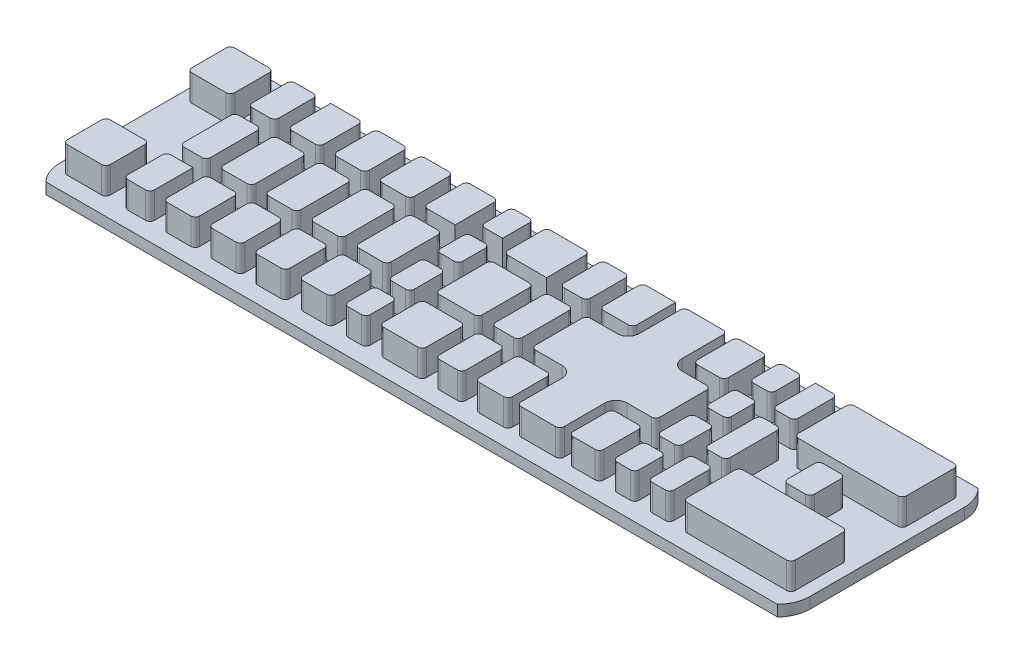
from build123d import *

# Parameters (mm, degrees)
SKETCH1_W                = 218.44
SKETCH1_H                = 50.8
BOSS_EXTRUDE1_DEPTH      = 2.54
SKETCH5_W                = 9.906
SKETCH5_H                = 9.906
SKETCH5_W_2              = 6.096
SKETCH5_H_2              = 12.7
SKETCH5_W_3              = 7.366
SKETCH5_W_4              = 5.08
SKETCH5_H_3              = 7.112
SKETCH5_H_4              = 8.128
SKETCH5_W_5              = 7.62
SKETCH5_W_6              = 7.112
SKETCH5_W_7              = 5.0038
SKETCH5_H_5              = 6.828713061
SKETCH5_H_6              = 8.141940284
SKETCH5_W_8              = 24.9174
SKETCH5_H_7              = 12.954
BOSS_EXTRUDE4_DEPTH      = 6.096
FILLET8_R                = 2.54
FILLET9_R                = 7.62
FILLET10_R               = 1.016
FILLET11_R               = 1.016
SKETCH10_W               = 7.932558553
SKETCH10_H               = 50.796984233
CUT_EXTRUDE4_DEPTH       = 113.466656819
SKETCH11_W               = 11.285421997
SKETCH11_H               = 50.860782752
CUT_EXTRUDE5_DEPTH       = 10.16
SKETCH12_R               = 2.54
CUT_EXTRUDE6_DEPTH       = 1.27
SKETCH15_W               = 30.193219406
SKETCH15_H               = 50.796984233
CUT_EXTRUDE9_DEPTH       = 106.289623737
SKETCH17_W               = 30.370824295
SKETCH17_H               = 2.54
CUT_EXTRUDE11_DEPTH      = 115.111282819
CUT_EXTRUDE12_DEPTH      = 114.918717089
CUT_EXTRUDE12_DEPTH_BACK = 114.918717089
SKETCH18_W               = 0.041845094
SKETCH18_H               = 2.54
FILLET12_R               = 7.62
CUT_EXTRUDE14_DEPTH      = 106.082351021
CUT_EXTRUDE14_DEPTH_BACK = 3.81
SKETCH19_W               = 173.006780594
SKETCH19_H               = 2.286
CUT_EXTRUDE15_DEPTH      = 106.082351021
CUT_EXTRUDE15_DEPTH_BACK = 106.082351021
SKETCH20_W               = 173.059844392
SKETCH20_H               = 2.286
SKETCH21_R               = 0.381
CUT_EXTRUDE16_DEPTH      = 1.27


with BuildPart() as part:
    # Sketch1 → Boss-Extrude1 (new body)
    with BuildSketch(Plane(origin=(0, 0, 0), x_dir=(1, 0, 0), z_dir=(0, 1, 0))):
        Rectangle(SKETCH1_W, SKETCH1_H)
    extrude(amount=BOSS_EXTRUDE1_DEPTH)

    # Sketch5 → Boss-Extrude4 (add)
    with BuildSketch(Plane(origin=(0, 2.54, 0), x_dir=(1, 0, 0), z_dir=(0, 1, 0))):
        with BuildLine():
            Line((5.334, 19.304), (5.334, 6.35))
            Line((5.334, 6.35), (-4.318, 6.35))
            Line((-4.318, 6.35), (-4.318, -6.35))
            Line((-4.318, -6.35), (5.334, -6.35))
            Line((5.334, -6.35), (5.334, -19.304))
            Line((5.334, -19.304), (15.24, -19.304))
            Line((15.24, -19.304), (15.24, -8.89))
            ThreePointArc((15.24, -8.89), (15.983948776, -7.093948776), (17.78, -6.35))
            Line((17.78, -6.35), (24.384, -6.35))
            Line((24.384, -6.35), (24.384, 6.35))
            Line((24.384, 6.35), (17.78, 6.35))
            ThreePointArc((17.78, 6.35), (15.983948776, 7.093948776), (15.24, 8.89))
            Line((15.24, 8.89), (15.24, 19.304))
            Line((15.24, 19.304), (5.334, 19.304))
        make_face()
        with Locations((-94.361, 14.351)):
            Rectangle(SKETCH5_W, SKETCH5_H)
        with Locations((-94.361, -14.351)):
            Rectangle(SKETCH5_W, SKETCH5_H)
        with Locations((-82.296, -14.351)):
            Rectangle(SKETCH5_W_2, SKETCH5_H)
        with Locations((-82.296, 0)):
            Rectangle(SKETCH5_W_2, SKETCH5_H_2)
        with Locations((-82.296, 14.351)):
            Rectangle(SKETCH5_W_2, SKETCH5_H)
        with Locations((-72.517, 14.351)):
            Rectangle(SKETCH5_W_3, SKETCH5_H)
        with Locations((-72.517, 0)):
            Rectangle(SKETCH5_W_3, SKETCH5_H_2)
        with Locations((-72.517, -14.351)):
            Rectangle(SKETCH5_W_3, SKETCH5_H)
        with Locations((-62.103, -14.351)):
            Rectangle(SKETCH5_W_3, SKETCH5_H)
        with Locations((-62.103, 0)):
            Rectangle(SKETCH5_W_3, SKETCH5_H_2)
        with Locations((-62.103, 14.351)):
            Rectangle(SKETCH5_W_3, SKETCH5_H)
        with Locations((-51.689, 14.351)):
            Rectangle(SKETCH5_W_3, SKETCH5_H)
        with Locations((-51.689, 0)):
            Rectangle(SKETCH5_W_3, SKETCH5_H_2)
        with Locations((-51.689, -14.351)):
            Rectangle(SKETCH5_W_3, SKETCH5_H)
        with Locations((-41.275, -14.351)):
            Rectangle(SKETCH5_W_3, SKETCH5_H)
        with Locations((-41.275, 0)):
            Rectangle(SKETCH5_W_3, SKETCH5_H_2)
        with Locations((-41.275, 14.351)):
            Rectangle(SKETCH5_W_3, SKETCH5_H)
        with Locations((-32.004, 15.748)):
            Rectangle(SKETCH5_W_4, SKETCH5_H_3)
        with Locations((-32.004, 5.588)):
            Rectangle(SKETCH5_W_4, SKETCH5_H_3)
        with Locations((-32.004, -5.08)):
            Rectangle(SKETCH5_W_4, SKETCH5_H_4)
        with Locations((-21.463, 0)):
            Rectangle(SKETCH5_W, SKETCH5_H_2)
        with Locations((-21.463, 14.351)):
            Rectangle(SKETCH5_W, SKETCH5_H)
        with Locations((-10.414, 14.351)):
            Rectangle(SKETCH5_W_2, SKETCH5_H)
        with Locations((-0.508, 14.351)):
            Rectangle(SKETCH5_W_5, SKETCH5_H)
        with Locations((-10.414, 0)):
            Rectangle(SKETCH5_W_2, SKETCH5_H_2)
        with Locations((-32.004, -15.748)):
            Rectangle(SKETCH5_W_4, SKETCH5_H_3)
        with Locations((-21.463, -14.351)):
            Rectangle(SKETCH5_W, SKETCH5_H)
        with Locations((-10.414, -14.351)):
            Rectangle(SKETCH5_W_2, SKETCH5_H)
        with Locations((-0.508, -14.351)):
            Rectangle(SKETCH5_W_5, SKETCH5_H)
        with Locations((20.828, -14.351)):
            Rectangle(SKETCH5_W_6, SKETCH5_H)
        with Locations((29.972, -15.748)):
            Rectangle(SKETCH5_W_4, SKETCH5_H_3)
        with Locations((38.0619, -14.351)):
            Rectangle(SKETCH5_W_7, SKETCH5_H)
        with Locations((29.972, -5.08)):
            Rectangle(SKETCH5_W_4, SKETCH5_H_4)
        with Locations((29.972, 5.446356531)):
            Rectangle(SKETCH5_W_4, SKETCH5_H_5)
        with Locations((29.972, 15.748)):
            Rectangle(SKETCH5_W_4, SKETCH5_H_3)
        with Locations((20.828, 14.351)):
            Rectangle(SKETCH5_W_6, SKETCH5_H)
        with Locations((38.0619, 14.351)):
            Rectangle(SKETCH5_W_7, SKETCH5_H)
        with Locations((38.0619, 0)):
            Rectangle(SKETCH5_W_7, SKETCH5_H_2)
        with Locations((54.5338, 0.08685337)):
            Rectangle(SKETCH5_W_2, SKETCH5_H_6)
        with Locations((56.0705, -12.827)):
            Rectangle(SKETCH5_W_8, SKETCH5_H_7)
        with Locations((56.0705, 12.827)):
            Rectangle(SKETCH5_W_8, SKETCH5_H_7)
    extrude(amount=BOSS_EXTRUDE4_DEPTH)

    # Fillet8
    fillet8_edges = [part.edges().sort_by_distance(p)[0] for p in [
        (5.334, 5.588, -6.35),
        (5.334, 5.588, 6.35),
    ]]
    fillet(fillet8_edges, radius=FILLET8_R)

    # Fillet9
    fillet9_edges = [part.edges().sort_by_distance(p)[0] for p in [
        (-109.22, 1.27, -25.4),
        (-109.22, 1.27, 25.4),
        (109.22, 1.27, 25.4),
        (109.22, 1.27, -25.4),
    ]]
    fillet(fillet9_edges, radius=FILLET9_R)

    # Fillet10
    fillet10_edges = [part.edges().sort_by_distance(p)[0] for p in [
        (40.5638, 5.588, -6.35),
        (32.512, 5.588, -8.860713061),
        (32.512, 5.588, -19.304),
        (40.5638, 5.588, -19.304),
        (17.272, 5.588, -19.304),
        (24.384, 5.588, -19.304),
        (27.432, 5.588, -19.304),
        (27.432, 5.588, -8.860713061),
        (27.432, 5.588, 1.016),
        (27.432, 5.588, 12.192),
        (24.384, 5.588, 9.398),
        (32.512, 5.588, -12.192),
        (32.512, 5.588, -2.032),
        (32.512, 5.588, 1.016),
        (32.512, 5.588, 12.192),
        (32.512, 5.588, 9.144),
        (24.384, 5.588, 19.304),
        (17.272, 5.588, 19.304),
        (17.272, 5.588, 9.398),
        (17.272, 5.588, -9.398),
        (24.384, 5.588, -9.398),
        (27.432, 5.588, -12.192),
        (27.432, 5.588, -2.032),
        (27.432, 5.588, 9.144),
        (27.432, 5.588, 19.304),
        (32.512, 5.588, 19.304),
        (35.56, 5.588, -6.35),
        (40.5638, 5.588, -9.398),
        (35.56, 5.588, -9.398),
        (35.56, 5.588, 6.35),
        (35.56, 5.588, 9.398),
        (35.56, 5.588, 19.304),
        (40.5638, 5.588, 19.304),
        (40.5638, 5.588, 6.35),
        (40.5638, 5.588, 9.398),
        (43.6118, 5.588, -6.35),
        (43.6118, 5.588, -19.304),
        (68.5292, 5.588, -19.304),
        (68.5292, 5.588, -6.35),
        (57.5818, 5.588, -4.157823512),
        (51.4858, 5.588, -4.157823512),
        (57.5818, 5.588, 3.984116772),
        (51.4858, 5.588, 3.984116772),
        (43.6118, 5.588, 6.35),
        (43.6118, 5.588, 19.304),
        (68.5292, 5.588, 6.35),
        (68.5292, 5.588, 19.304),
    ]]
    fillet(fillet10_edges, radius=FILLET10_R)

    # Fillet11
    fillet11_edges = [part.edges().sort_by_distance(p)[0] for p in [
        (-89.408, 5.588, -9.398),
        (-89.408, 5.588, 9.398),
        (-99.314, 5.588, -9.398),
        (-99.314, 5.588, -19.304),
        (-89.408, 5.588, -19.304),
        (-85.344, 5.588, -19.304),
        (-79.248, 5.588, -6.35),
        (-68.834, 5.588, -6.35),
        (-65.786, 5.588, -19.304),
        (-79.248, 5.588, -19.304),
        (-68.834, 5.588, -19.304),
        (-58.42, 5.588, -9.398),
        (-58.42, 5.588, -6.35),
        (-34.544, 5.588, 9.144),
        (-58.42, 5.588, 6.35),
        (-48.006, 5.588, 6.35),
        (-68.834, 5.588, 9.398),
        (-68.834, 5.588, 6.35),
        (-65.786, 5.588, 6.35),
        (-68.834, 5.588, -9.398),
        (-65.786, 5.588, -9.398),
        (-65.786, 5.588, -6.35),
        (-76.2, 5.588, -6.35),
        (-76.2, 5.588, -9.398),
        (-79.248, 5.588, -9.398),
        (-85.344, 5.588, -9.398),
        (-85.344, 5.588, -6.35),
        (-85.344, 5.588, 6.35),
        (-79.248, 5.588, 6.35),
        (-76.2, 5.588, 6.35),
        (-76.2, 5.588, 9.398),
        (-68.834, 5.588, 19.304),
        (-76.2, 5.588, 19.304),
        (-79.248, 5.588, 19.304),
        (-89.408, 5.588, 19.304),
        (-85.344, 5.588, 19.304),
        (-85.344, 5.588, 9.398),
        (-99.314, 5.588, 9.398),
        (-99.314, 5.588, 19.304),
        (-55.372, 5.588, 6.35),
        (-55.372, 5.588, -6.35),
        (-55.372, 5.588, -9.398),
        (-34.544, 5.588, -12.192),
        (-44.958, 5.588, -9.398),
        (-44.958, 5.588, 6.35),
        (3.302, 5.588, -9.398),
        (-29.464, 5.588, -2.032),
        (3.302, 5.588, 9.398),
        (-7.366, 5.588, -9.398),
        (-7.366, 5.588, -6.35),
        (-48.006, 5.588, -9.398),
        (-55.372, 5.588, -19.304),
        (-58.42, 5.588, -19.304),
        (-48.006, 5.588, -19.304),
        (-48.006, 5.588, -6.35),
        (-37.592, 5.588, 9.398),
        (-34.544, 5.588, 19.304),
        (-44.958, 5.588, 19.304),
        (-65.786, 5.588, 19.304),
        (-65.786, 5.588, 9.398),
        (-58.42, 5.588, 9.398),
        (-55.372, 5.588, 9.398),
        (-48.006, 5.588, 9.398),
        (-44.958, 5.588, 9.398),
        (-34.544, 5.588, -2.032),
        (-29.464, 5.588, 1.016),
        (-34.544, 5.588, 1.016),
        (-34.544, 5.588, 12.192),
        (-26.416, 5.588, 9.398),
        (-4.318, 5.588, 9.398),
        (-13.462, 5.588, 9.398),
        (-26.416, 5.588, -6.35),
        (-16.51, 5.588, -6.35),
        (-13.462, 5.588, -6.35),
        (-13.462, 5.588, -9.398),
        (-26.416, 5.588, -9.398),
        (-29.464, 5.588, -9.144),
        (-34.544, 5.588, -9.144),
        (-37.592, 5.588, -6.35),
        (-44.958, 5.588, -6.35),
        (-44.958, 5.588, -19.304),
        (-37.592, 5.588, -19.304),
        (-34.544, 5.588, -19.304),
        (-29.464, 5.588, -19.304),
        (-26.416, 5.588, -19.304),
        (-16.51, 5.588, -19.304),
        (-13.462, 5.588, -19.304),
        (-7.366, 5.588, -19.304),
        (15.24, 5.588, -19.304),
        (5.334, 5.588, -19.304),
        (-4.318, 5.588, -19.304),
        (-4.318, 5.588, -9.398),
        (-4.318, 5.588, -6.35),
        (-16.51, 5.588, 9.398),
        (-7.366, 5.588, 9.398),
        (-4.318, 5.588, 6.35),
        (-7.366, 5.588, 6.35),
        (-13.462, 5.588, 6.35),
        (-16.51, 5.588, 6.35),
        (-26.416, 5.588, 6.35),
        (-29.464, 5.588, 12.192),
        (-29.464, 5.588, 9.144),
        (-37.592, 5.588, 6.35),
        (-58.42, 5.588, 19.304),
        (-55.372, 5.588, 19.304),
        (-48.006, 5.588, 19.304),
        (-37.592, 5.588, 19.304),
        (-29.464, 5.588, 19.304),
        (-26.416, 5.588, 19.304),
        (-16.51, 5.588, 19.304),
        (-13.462, 5.588, 19.304),
        (-7.366, 5.588, 19.304),
        (-4.318, 5.588, 19.304),
        (3.302, 5.588, 19.304),
        (5.334, 5.588, 19.304),
        (15.24, 5.588, 19.304),
        (24.384, 5.588, -6.35),
        (24.384, 5.588, 6.35),
    ]]
    fillet(fillet11_edges, radius=FILLET11_R)

    # Sketch10 → Cut-Extrude4 (cut, through all)
    with BuildSketch(Plane(origin=(0, 0, 0), x_dir=(1, 0, 0), z_dir=(0, 1, 0))):
        with Locations((105.566279277, 0.001507884)):
            Rectangle(SKETCH10_W, SKETCH10_H)
    extrude(amount=CUT_EXTRUDE4_DEPTH, mode=Mode.SUBTRACT)

    # Sketch11 → Cut-Extrude5 (cut)
    with BuildSketch(Plane(origin=(0, 0, 0), x_dir=(1, 0, 0), z_dir=(0, 1, 0))):
        with Locations((-107.242710999, -0.030391376)):
            Rectangle(SKETCH11_W, SKETCH11_H)
    extrude(amount=CUT_EXTRUDE5_DEPTH, mode=Mode.SUBTRACT)

    # Sketch12 → Cut-Extrude6 (cut)
    with BuildSketch(Plane.XZ):
        with Locations((25.4, 0)):
            Circle(SKETCH12_R)
    extrude(amount=-CUT_EXTRUDE6_DEPTH, mode=Mode.SUBTRACT)

    # Sketch15 → Cut-Extrude9 (cut, through all)
    with BuildSketch(Plane(origin=(0, 0, 0), x_dir=(1, 0, 0), z_dir=(0, 1, 0))):
        with Locations((86.503390297, 0.001507884)):
            Rectangle(SKETCH15_W, SKETCH15_H)
    extrude(amount=CUT_EXTRUDE9_DEPTH, mode=Mode.SUBTRACT)

    # Sketch17 → Cut-Extrude11 (cut, through all)
    with BuildSketch(Plane.XY.offset(25.4)):
        with Locations((86.634037836, 1.27)):
            Rectangle(SKETCH17_W, SKETCH17_H)
    extrude(amount=-CUT_EXTRUDE11_DEPTH, mode=Mode.SUBTRACT)

    # Sketch18 → Cut-Extrude12 (cut, two sides: drawn at the far end of the back side and taken through both)
    with BuildSketch(Plane(origin=(0, 0, 25.396984233), x_dir=(-1, 0, 0), z_dir=(0, 0, -1)).offset(-CUT_EXTRUDE12_DEPTH_BACK)):
        with Locations((-71.427703141, 1.27)):
            Rectangle(SKETCH18_W, SKETCH18_H)
    extrude(amount=CUT_EXTRUDE12_DEPTH + CUT_EXTRUDE12_DEPTH_BACK, mode=Mode.SUBTRACT)

    # Fillet12
    fillet12_edges = [part.edges().sort_by_distance(p)[0] for p in [
        (-101.6, 1.27, 25.4),
        (-101.6, 1.27, -25.4),
        (71.406780594, 1.27, -25.4),
        (71.406780594, 1.27, 25.4),
    ]]
    fillet(fillet12_edges, radius=FILLET12_R)

    # Sketch19 → Cut-Extrude14 (cut, two sides: drawn at the far end of the back side and taken through both)
    with BuildSketch(Plane(origin=(0, 0, 0), x_dir=(1, 0, 0), z_dir=(0, 1, 0)).offset(-CUT_EXTRUDE14_DEPTH_BACK)):
        with Locations((-15.096609703, 24.311153673)):
            Rectangle(SKETCH19_W, SKETCH19_H)
    extrude(amount=CUT_EXTRUDE14_DEPTH + CUT_EXTRUDE14_DEPTH_BACK, mode=Mode.SUBTRACT)

    # Sketch20 → Cut-Extrude15 (cut, two sides: drawn at the far end of the back side and taken through both)
    with BuildSketch(Plane(origin=(0, 0, 0), x_dir=(1, 0, 0), z_dir=(0, 1, 0)).offset(-CUT_EXTRUDE15_DEPTH_BACK)):
        with Locations((-15.070077804, -24.257)):
            Rectangle(SKETCH20_W, SKETCH20_H)
    extrude(amount=CUT_EXTRUDE15_DEPTH + CUT_EXTRUDE15_DEPTH_BACK, mode=Mode.SUBTRACT)

    # Sketch21 → Cut-Extrude16 (cut)
    with BuildSketch(Plane.XZ):
        with Locations((54.642780594, 15.7988)):
            Circle(SKETCH21_R)
    cut_extrude16 = extrude(amount=-CUT_EXTRUDE16_DEPTH, mode=Mode.SUBTRACT)

    # Mirror1: Cut-Extrude16 across plane
    add(cut_extrude16.mirror(Plane.XY), mode=Mode.SUBTRACT)


solid = part.part
